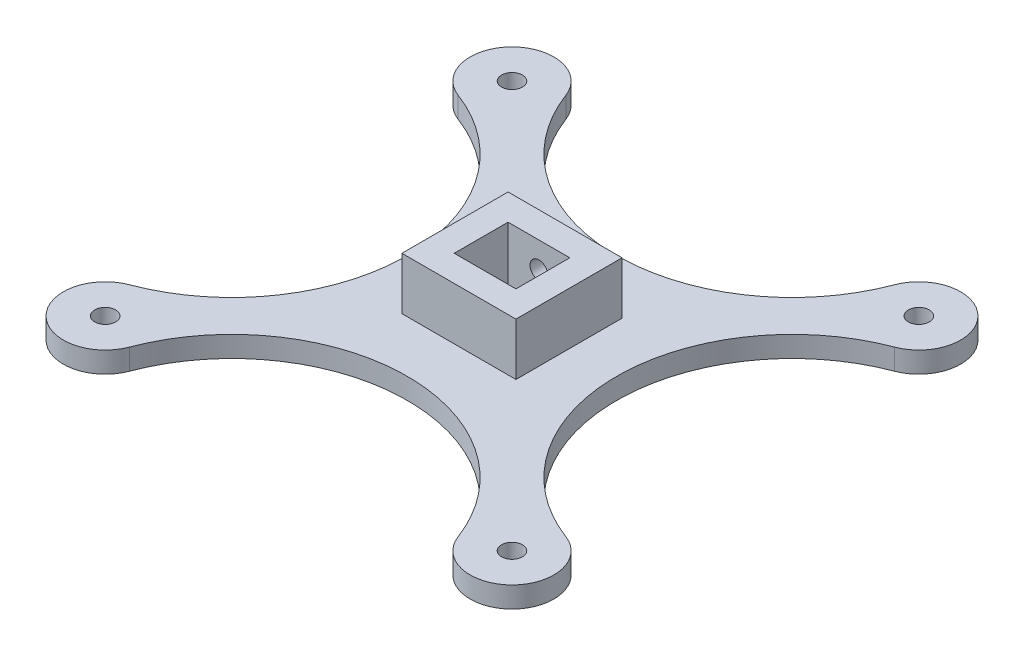
from build123d import *

# Parameters (mm, degrees)
SKETCH1_R                = 2
BOSS_EXTRUDE1_DEPTH      = 4
SKETCH7_W                = 21.8
SKETCH7_H                = 20.3
SKETCH7_W_2              = 11.8
SKETCH7_H_2              = 10.3
BOSS_EXTRUDE2_DEPTH      = 10
M3_CLEARANCE_HOLE1_D     = 3.4
M3_CLEARANCE_HOLE1_DEPTH = 5
SKETCH7_2_W              = 11.8
SKETCH7_2_H              = 10.3
CUT_EXTRUDE1_DEPTH       = 10


with BuildPart() as part:
    # Sketch1 → Boss-Extrude1 (new body)
    with BuildSketch(Plane(origin=(0, 0, 0), x_dir=(1, 0, 0), z_dir=(0, 1, 0))):
        with BuildLine():
            ThreePointArc((-31.406166481, 41.715615227), (-44.547727215, 44.547727215), (-41.715615227, 31.406166481))
            ThreePointArc((-41.715615227, 31.406166481), (-20, 0), (-41.715615227, -31.406166481))
            ThreePointArc((-41.715615227, -31.406166481), (-44.547727215, -44.547727215), (-31.406166481, -41.715615227))
            ThreePointArc((-31.406166481, -41.715615227), (0, -20), (31.406166481, -41.715615227))
            ThreePointArc((31.406166481, -41.715615227), (44.547727215, -44.547727215), (41.715615227, -31.406166481))
            ThreePointArc((41.715615227, -31.406166481), (20, 0), (41.715615227, 31.406166481))
            ThreePointArc((41.715615227, 31.406166481), (44.547727215, 44.547727215), (31.406166481, 41.715615227))
            ThreePointArc((31.406166481, 41.715615227), (0, 20), (-31.406166481, 41.715615227))
        make_face()
        with Locations(Location((-38.890872965, 38.890872965, 0), (0, 0, 270))):
            Circle(SKETCH1_R, mode=Mode.SUBTRACT)
        with Locations(Location((38.890872965, 38.890872965, 0), (0, 0, 270))):
            Circle(SKETCH1_R, mode=Mode.SUBTRACT)
        with Locations(Location((38.890872965, -38.890872965, 0), (0, 0, 270))):
            Circle(SKETCH1_R, mode=Mode.SUBTRACT)
        with Locations(Location((-38.890872965, -38.890872965, 0), (0, 0, 270))):
            Circle(SKETCH1_R, mode=Mode.SUBTRACT)
    extrude(amount=BOSS_EXTRUDE1_DEPTH)

    # Sketch7 → Boss-Extrude2 (add)
    with BuildSketch(Plane.XZ.offset(-4)):
        Rectangle(SKETCH7_W, SKETCH7_H)
        Rectangle(SKETCH7_W_2, SKETCH7_H_2, mode=Mode.SUBTRACT)
    extrude(amount=-BOSS_EXTRUDE2_DEPTH)

    # M3 Clearance Hole1
    with Locations(Plane(origin=(0, 9, -10.15), x_dir=(-1, 0, 0), z_dir=(0, 0, -1))):
        with Locations((0, 0)):
            Hole(M3_CLEARANCE_HOLE1_D / 2, depth=M3_CLEARANCE_HOLE1_DEPTH)

    # Sketch7<2> → Cut-Extrude1 (cut)
    with BuildSketch(Plane.XZ.offset(-4)):
        Rectangle(SKETCH7_2_W, SKETCH7_2_H)
    extrude(amount=CUT_EXTRUDE1_DEPTH, mode=Mode.SUBTRACT)


solid = part.part
